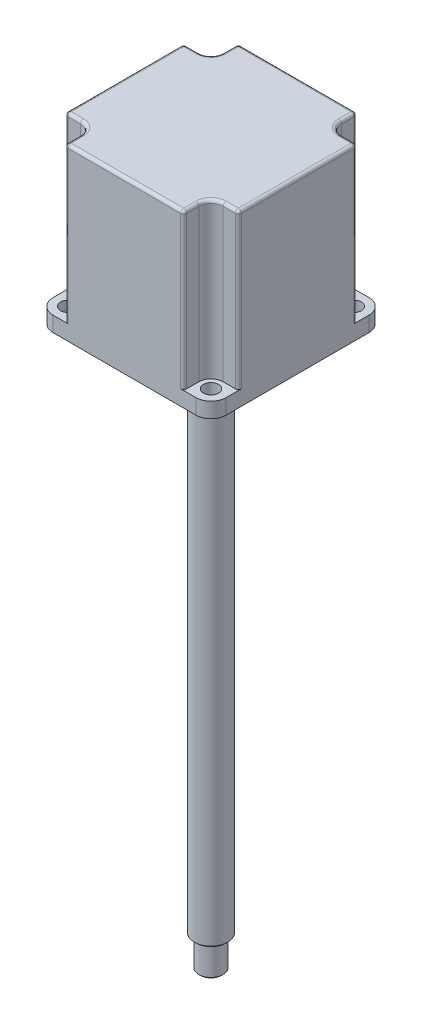
from build123d import *

# Parameters (mm, degrees)
SKETCH1_W                = 57
SKETCH1_H                = 57
EXTRUDE1_DEPTH           = 76
F_5_0_5_DIAMETER_HOLE1_D = 5
SKETCH6_R                = 4
SKETCH6_R_2              = 2.5
EXTRUDE4_DEPTH           = 71
FILLET1_R                = 5
SKETCH7_R                = 3
EXTRUDE5_DEPTH           = 101
SKETCH8_R                = 15
EXTRUDE6_DEPTH           = 3
FILLET2_R                = 1
SKETCH9_R                = 5.5
BOSS_EXTRUDE1_DEPTH      = 174
CHAMFER1_SIZE            = 0.5
SKETCH10_R               = 4
BOSS_EXTRUDE2_DEPTH      = 10
CHAMFER2_SIZE            = 0.5
CUT_EXTRUDE1_REACH       = 196.724
SKETCH11_W               = 136.965596246
SKETCH11_H               = 58.892429462
FILLET3_R                = 1


with BuildPart() as part:
    # Sketch1 → Extrude1 (new body)
    with BuildSketch(Plane(origin=(0, 0, 0), x_dir=(1, 0, 0), z_dir=(0, 1, 0))):
        Rectangle(SKETCH1_W, SKETCH1_H)
    extrude(amount=EXTRUDE1_DEPTH)

    # Ø5.0 (5) Diameter Hole1 (through all)
    with Locations(Plane.XZ):
        with Locations((-23.5, 23.5), (23.5, 23.5), (23.5, -23.5), (-23.5, -23.5)):
            Hole(F_5_0_5_DIAMETER_HOLE1_D / 2)

    # Sketch6 → Extrude4 (cut)
    # profile 1 of 12: a face of its own
    with BuildSketch(Plane(origin=(0, 76, 0), x_dir=(1, 0, 0), z_dir=(0, 1, 0))):
        Polygon((-28.5, 28.5), (-19.5, 28.5), (-19.5, 32.511741208), (-33.908905561, 32.511741208), (-33.908905561, 19.5), (-28.5, 19.5), align=None)
    # profile 2 of 12: a face of its own
    with BuildSketch(Plane(origin=(0, 76, 0), x_dir=(1, 0, 0), z_dir=(0, 1, 0))):
        with BuildLine():
            ThreePointArc((-23.5, 19.5), (-26.328427125, 26.328427125), (-19.5, 23.5))
            Line((-19.5, 23.5), (-19.5, 28.5))
            Line((-19.5, 28.5), (-28.5, 28.5))
            Line((-28.5, 28.5), (-28.5, 19.5))
            Line((-28.5, 19.5), (-23.5, 19.5))
        make_face()
    # profile 3 of 12: a face of its own
    with BuildSketch(Plane(origin=(0, 76, 0), x_dir=(1, 0, 0), z_dir=(0, 1, 0))):
        with Locations((-23.5, 23.5)):
            Circle(SKETCH6_R)
        with Locations(Location((-23.5, 23.5, 0), (0, 0, 90))):
            Circle(SKETCH6_R_2, mode=Mode.SUBTRACT)
    # profile 4 of 12: a face of its own
    with BuildSketch(Plane(origin=(0, 76, 0), x_dir=(1, 0, 0), z_dir=(0, 1, 0))):
        Polygon((19.5, 36.471560472), (19.5, 28.5), (28.5, 28.5), (28.5, 19.5), (41.168352552, 19.5), (41.168352552, 36.471560472), align=None)
    # profile 5 of 12: a face of its own
    with BuildSketch(Plane(origin=(0, 76, 0), x_dir=(1, 0, 0), z_dir=(0, 1, 0))):
        with BuildLine():
            Line((28.5, 28.5), (19.5, 28.5))
            Line((19.5, 28.5), (19.5, 23.5))
            ThreePointArc((19.5, 23.5), (23.5, 27.5), (27.5, 23.5))
            ThreePointArc((27.5, 23.5), (26.328427125, 20.671572875), (23.5, 19.5))
            Line((23.5, 19.5), (28.5, 19.5))
            Line((28.5, 19.5), (28.5, 28.5))
        make_face()
    # profile 6 of 12: a face of its own
    with BuildSketch(Plane(origin=(0, 76, 0), x_dir=(1, 0, 0), z_dir=(0, 1, 0))):
        with Locations((23.5, 23.5)):
            Circle(SKETCH6_R)
        with Locations(Location((23.5, 23.5, 0), (0, 0, 90))):
            Circle(SKETCH6_R_2, mode=Mode.SUBTRACT)
    # profile 7 of 12: a face of its own
    with BuildSketch(Plane(origin=(0, 76, 0), x_dir=(1, 0, 0), z_dir=(0, 1, 0))):
        with Locations((23.5, -23.5)):
            Circle(SKETCH6_R)
        with Locations(Location((23.5, -23.5, 0), (0, 0, 90))):
            Circle(SKETCH6_R_2, mode=Mode.SUBTRACT)
    # profile 8 of 12: a face of its own
    with BuildSketch(Plane(origin=(0, 76, 0), x_dir=(1, 0, 0), z_dir=(0, 1, 0))):
        with BuildLine():
            Line((28.5, -28.5), (28.5, -19.5))
            Line((28.5, -19.5), (23.5, -19.5))
            ThreePointArc((23.5, -19.5), (26.328427125, -20.671572875), (27.5, -23.5))
            ThreePointArc((27.5, -23.5), (23.5, -27.5), (19.5, -23.5))
            Line((19.5, -23.5), (19.5, -28.5))
            Line((19.5, -28.5), (28.5, -28.5))
        make_face()
    # profile 9 of 12: a face of its own
    with BuildSketch(Plane(origin=(0, 76, 0), x_dir=(1, 0, 0), z_dir=(0, 1, 0))):
        Polygon((44.252209519, -19.5), (28.5, -19.5), (28.5, -28.5), (19.5, -28.5), (19.5, -40.050429997), (44.252209519, -40.050429997), align=None)
    # profile 10 of 12: a face of its own
    with BuildSketch(Plane(origin=(0, 76, 0), x_dir=(1, 0, 0), z_dir=(0, 1, 0))):
        Polygon((-28.5, -28.5), (-28.5, -19.5), (-37.670786859, -19.5), (-37.670786859, -37.828231874), (-19.5, -37.828231874), (-19.5, -28.5), align=None)
    # profile 11 of 12: a face of its own
    with BuildSketch(Plane(origin=(0, 76, 0), x_dir=(1, 0, 0), z_dir=(0, 1, 0))):
        with BuildLine():
            Line((-23.5, -19.5), (-28.5, -19.5))
            Line((-28.5, -19.5), (-28.5, -28.5))
            Line((-28.5, -28.5), (-19.5, -28.5))
            Line((-19.5, -28.5), (-19.5, -23.5))
            ThreePointArc((-19.5, -23.5), (-26.328427125, -26.328427125), (-23.5, -19.5))
        make_face()
    # profile 12 of 12: a face of its own
    with BuildSketch(Plane(origin=(0, 76, 0), x_dir=(1, 0, 0), z_dir=(0, 1, 0))):
        with Locations((-23.5, -23.5)):
            Circle(SKETCH6_R)
        with Locations(Location((-23.5, -23.5, 0), (0, 0, 90))):
            Circle(SKETCH6_R_2, mode=Mode.SUBTRACT)
    extrude(amount=-EXTRUDE4_DEPTH, mode=Mode.SUBTRACT)

    # Fillet1
    fillet1_edges = [part.edges().sort_by_distance(p)[0] for p in [
        (-28.5, 2.5, 28.5),
        (-28.5, 2.5, -28.5),
        (28.5, 2.5, -28.5),
        (28.5, 2.5, 28.5),
    ]]
    fillet(fillet1_edges, radius=FILLET1_R)



with BuildPart() as body_2:
    # Sketch7 → Extrude5 (new body)
    with BuildSketch(Plane(origin=(0, 76, 0), x_dir=(1, 0, 0), z_dir=(0, 1, 0))):
        with Locations(Location((0, 0, 0), (0, 0, 270))):
            Circle(SKETCH7_R)
    extrude(amount=-EXTRUDE5_DEPTH)


with BuildPart() as part_1:
    add(part.part)

    add(body_2.part)  # Extrude6 merges body 2
    # Sketch8 → Extrude6 (add)
    with BuildSketch(Plane.XZ):
        with Locations(Location((0, 0, 0), (0, 0, 270))):
            Circle(SKETCH8_R)
    extrude(amount=EXTRUDE6_DEPTH)

    # Fillet2
    fillet2_edges = [part_1.edges().sort_by_distance(p)[0] for p in [
        (-28.5, 40.5, 19.5),
        (0, 76, 28.5),
        (-19.5, 40.5, 28.5),
        (-19.5, 76, 26),
        (-20.671572875, 76, 20.671572875),
        (-26, 76, 19.5),
        (-28.5, 76, 0),
        (-28.5, 40.5, -19.5),
        (-19.5, 40.5, -28.5),
        (-19.5, 76, -26),
        (-26, 76, -19.5),
        (-20.671572875, 76, -20.671572875),
        (0, 76, -28.5),
        (19.5, 76, -26),
        (26, 76, -19.5),
        (20.671572875, 76, -20.671572875),
        (19.5, 40.5, -28.5),
        (28.5, 40.5, -19.5),
        (19.5, 40.5, 28.5),
        (28.5, 76, 0),
        (26, 76, 19.5),
        (19.5, 76, 26),
        (20.671572875, 76, 20.671572875),
        (28.5, 40.5, 19.5),
    ]]
    fillet(fillet2_edges, radius=FILLET2_R)

    # Sketch9 → Boss-Extrude1 (add)
    with BuildSketch(Plane.XZ):
        with Locations(Location((0, 0, 0), (0, 0, 270))):
            Circle(SKETCH9_R)
    extrude(amount=BOSS_EXTRUDE1_DEPTH)

    # Chamfer1
    chamfer1_edges = [part_1.edges().sort_by_distance(p)[0] for p in [
        (0, -174, 5.5),
    ]]
    chamfer(chamfer1_edges, length=CHAMFER1_SIZE)

    # Sketch10 → Boss-Extrude2 (add)
    with BuildSketch(Plane.XZ.offset(174)):
        with Locations(Location((0, 0, 0), (0, 0, 270))):
            Circle(SKETCH10_R)
    extrude(amount=BOSS_EXTRUDE2_DEPTH)

    # Chamfer2
    chamfer2_edges = [part_1.edges().sort_by_distance(p)[0] for p in [
        (0, -184, 4),
    ]]
    chamfer(chamfer2_edges, length=CHAMFER2_SIZE)

    # Sketch11 → Cut-Extrude1 (cut, up to next)
    with BuildSketch(Plane.XY.offset(28.5), mode=Mode.PRIVATE) as cut_extrude1_sk1:
        with Locations((0.168266434, 85.446214731)):
            Rectangle(SKETCH11_W, SKETCH11_H)
    cut_extrude1_tool1 = extrude(cut_extrude1_sk1.sketch, amount=-CUT_EXTRUDE1_REACH, mode=Mode.PRIVATE) & part_1.part
    add(cut_extrude1_tool1.solids().sort_by_distance((0.168266, 85.446215, 28.5))[0], mode=Mode.SUBTRACT)

    # Fillet3
    fillet3_edges = [part_1.edges().sort_by_distance(p)[0] for p in [
        (0, 56, 28.5),
        (19.5, 56, 25.5),
        (19.207106781, 56, 28.207106781),
        (-19.207106781, 56, 28.207106781),
        (-28.207106781, 56, 19.207106781),
        (-28.207106781, 56, -19.207106781),
        (-19.207106781, 56, -28.207106781),
        (19.207106781, 56, -28.207106781),
        (19.5, 56, -25.5),
        (25.5, 56, -19.5),
        (28.207106781, 56, -19.207106781),
        (28.207106781, 56, 19.207106781),
        (25.5, 56, 19.5),
        (28.5, 56, 0),
        (0, 56, -28.5),
        (-28.5, 56, 0),
        (-25.5, 56, -19.5),
        (-19.5, 56, -25.5),
        (-20.671572875, 56, -20.671572875),
        (20.671572875, 56, -20.671572875),
        (20.671572875, 56, 20.671572875),
        (-19.5, 56, 25.5),
        (-25.5, 56, 19.5),
        (-20.671572875, 56, 20.671572875),
    ]]
    fillet(fillet3_edges, radius=FILLET3_R)


solid = part_1.part
